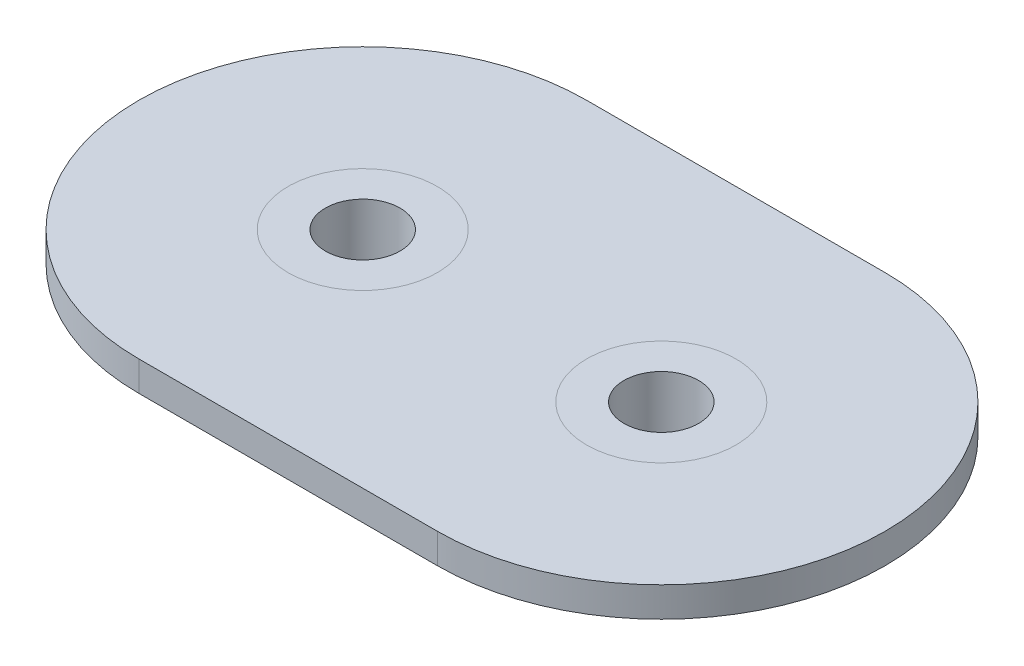
from build123d import *

# Parameters (mm, degrees)
SKETCH1_R                  = 5
BOSS_EXTRUDE1_DEPTH        = 2
BOSS_EXTRUDE2_DEPTH        = 2
BOSS_EXTRUDE2_DEPTH_BACK   = 6
SKETCH1_3_R                = 5
SKETCH1_3_R_2              = 2.5
BOSS_EXTRUDE2_2_DEPTH      = 2
BOSS_EXTRUDE2_2_DEPTH_BACK = 6


with BuildPart() as part:
    # Sketch1 → Boss-Extrude1 (new body)
    with BuildSketch(Plane(origin=(0, 0, 0), x_dir=(1, 0, 0), z_dir=(0, 1, 0))):
        with BuildLine():
            Line((10, 15), (-10, 15))
            ThreePointArc((-10, 15), (-25, 0), (-10, -15))
            Line((-10, -15), (10, -15))
            ThreePointArc((10, -15), (25, 0), (10, 15))
        make_face()
        with Locations((-10, 0)):
            Circle(SKETCH1_R, mode=Mode.SUBTRACT)
        with Locations((10, 0)):
            Circle(SKETCH1_R, mode=Mode.SUBTRACT)
    extrude(amount=BOSS_EXTRUDE1_DEPTH)


with BuildPart() as body_2:
    # Sketch1<3> → Boss-Extrude2 (new, two sides: drawn at the far end of the back side and taken through both)
    with BuildSketch(Plane(origin=(0, 0, 0), x_dir=(1, 0, 0), z_dir=(0, 1, 0)).offset(-BOSS_EXTRUDE2_DEPTH_BACK)):
        with Locations((-10, 0)):
            Circle(SKETCH1_3_R)
        with Locations((-10, 0)):
            Circle(SKETCH1_3_R_2, mode=Mode.SUBTRACT)
    extrude(amount=BOSS_EXTRUDE2_DEPTH + BOSS_EXTRUDE2_DEPTH_BACK)


with BuildPart() as body_3:
    # Sketch1<3> → Boss-Extrude2 2 (new, two sides: drawn at the far end of the back side and taken through both)
    with BuildSketch(Plane(origin=(0, 0, 0), x_dir=(1, 0, 0), z_dir=(0, 1, 0)).offset(-BOSS_EXTRUDE2_2_DEPTH_BACK)):
        with Locations((10, 0)):
            Circle(SKETCH1_3_R)
        with Locations((10, 0)):
            Circle(SKETCH1_3_R_2, mode=Mode.SUBTRACT)
    extrude(amount=BOSS_EXTRUDE2_2_DEPTH + BOSS_EXTRUDE2_2_DEPTH_BACK)


solid = Compound([part.part, body_2.part, body_3.part])
